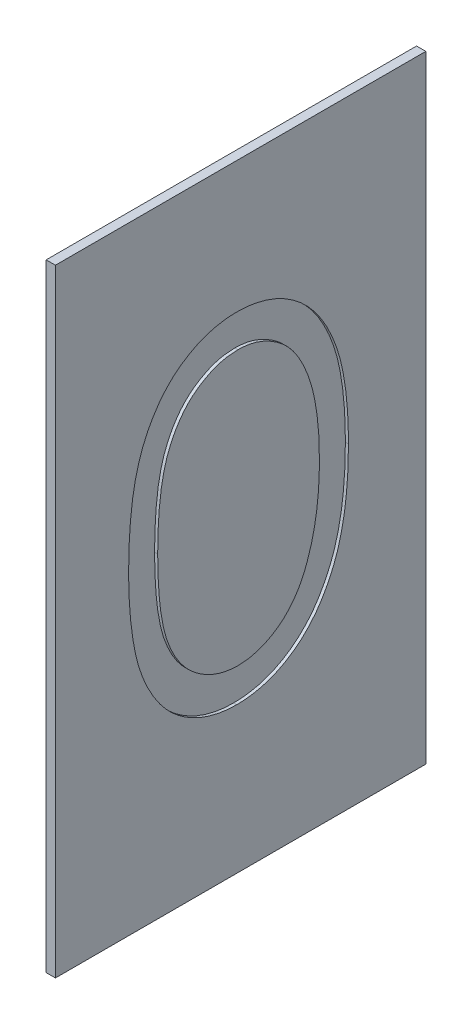
from build123d import *

# Parameters (mm, degrees)
SKETCH1_W           = 60
SKETCH1_H           = 100
BOSS_EXTRUDE1_DEPTH = 1.5
CUT_EXTRUDE1_DEPTH  = 0.5


with BuildPart() as part:
    # Sketch1 → Boss-Extrude1 (new body)
    with BuildSketch(Plane(origin=(0, 0, 0), x_dir=(0, 0, -1), z_dir=(1, 0, 0))):
        with Locations((30, 50)):
            Rectangle(SKETCH1_W, SKETCH1_H)
    extrude(amount=BOSS_EXTRUDE1_DEPTH)

    # Sketch2 → Cut-Extrude1 (cut)
    with BuildSketch(Plane(origin=(1.5, 0, 0), x_dir=(0, 0, -1), z_dir=(1, 0, 0))):
        with BuildLine():
            add(Edge.make_bspline(
                [(11.861572266, 51.178957621), (11.866483157, 52.01881409), (11.876022634, 53.650247385), (11.982146224, 56.027475881), (12.158439592, 58.257620052), (12.400038666, 60.340786644), (12.694046737, 62.277513452), (13.08652929, 64.062624774), (13.532868703, 65.704382682), (14.050167214, 67.208140834), (14.633869024, 68.594158719), (15.269169344, 69.888065036), (15.981280939, 71.087902015), (16.729505327, 72.212819981), (17.544130252, 73.244404803), (18.401973402, 74.197224604), (19.336516322, 75.049258251), (20.315990392, 75.825470017), (21.349263533, 76.505912268), (22.406883193, 77.105258438), (23.496129033, 77.617278353), (24.619974934, 78.019865843), (25.768319661, 78.352393329), (26.945177551, 78.57979315), (28.152491721, 78.722873456), (28.967406541, 78.736552342), (29.380690257, 78.743489583)],
                knots=[0, 0, 0, 0, 1.646270934, 3.197905019, 4.663502075, 6.030701355, 7.308322542, 8.50163776, 9.611534131, 10.641858119, 11.616356847, 12.558055219, 13.465016945, 14.349605745, 15.204443733, 16.039544428, 16.859896111, 17.680448484, 18.487036065, 19.28249412, 20.06191084, 20.843045899, 21.620316918, 22.403196591, 23.190181807, 24, 24, 24, 24], degree=3))
            add(Edge.make_bspline(
                [(29.380690257, 78.743489583), (29.797426358, 78.736186307), (30.626183347, 78.721662388), (31.851448395, 78.582069908), (33.048407114, 78.350445526), (34.211956508, 78.022257832), (35.351654181, 77.61510046), (36.458585764, 77.104768572), (37.539626914, 76.510720351), (38.577598427, 75.812695603), (39.583895365, 75.034448119), (40.53380024, 74.15468866), (41.427399518, 73.182300389), (42.275908223, 72.127687021), (43.055253425, 70.97062105), (43.797437142, 69.731226973), (44.46174867, 68.387830244), (45.101546615, 66.962845324), (45.653796473, 65.416843713), (46.151838759, 63.758540103), (46.554254567, 61.968347042), (46.889453334, 60.055657106), (47.149130721, 58.01344602), (47.338259067, 55.846091507), (47.438164497, 53.552167648), (47.456979074, 51.983795915), (47.466634115, 51.178957621)],
                knots=[0, 0, 0, 0, 0.810914788, 1.612654377, 2.396697861, 3.181598691, 3.963628158, 4.749916497, 5.551656086, 6.361998678, 7.18212741, 8.025565596, 8.878627764, 9.750805457, 10.657531673, 11.591944965, 12.560506719, 13.57287815, 14.630710178, 15.753379473, 16.941251878, 18.199788006, 19.531962791, 20.947069417, 22.433333509, 24, 24, 24, 24], degree=3))
            add(Edge.make_bspline(
                [(47.466634115, 51.178957621), (47.456878981, 50.37762975), (47.437871502, 48.816275072), (47.339379047, 46.532672726), (47.145370188, 44.376820324), (46.902683958, 42.343547476), (46.566561596, 40.441316956), (46.153273591, 38.663546241), (45.694395327, 37.002558092), (45.127955466, 35.471959765), (44.507979129, 34.050399477), (43.833439735, 32.722928074), (43.110772828, 31.477812184), (42.323445656, 30.325018121), (41.484247548, 29.256379647), (40.575217204, 28.290759896), (39.621979364, 27.404892058), (38.612721076, 26.616623447), (37.558561531, 25.926669372), (36.481233359, 25.309640305), (35.361621363, 24.812100312), (34.225098132, 24.38489078), (33.055407059, 24.05850748), (31.854006192, 23.83283075), (30.627006546, 23.674555371), (29.797567518, 23.662481237), (29.380690257, 23.65641276)],
                knots=[0, 0, 0, 0, 1.561518951, 3.042555995, 4.452378317, 5.7783523, 7.031515105, 8.214008947, 9.334062868, 10.386615937, 11.391082383, 12.354592575, 13.286541444, 14.194233754, 15.072674879, 15.931287219, 16.775624067, 17.606195743, 18.42308326, 19.229000347, 20.022332153, 20.807536673, 21.593273796, 22.3848459, 23.188221202, 24, 24, 24, 24], degree=3))
            add(Edge.make_bspline(
                [(29.380690257, 23.65641276), (28.967418006, 23.663394755), (28.152525794, 23.677161885), (26.945046018, 23.819595771), (25.773048192, 24.048590878), (24.630748974, 24.369227439), (23.512287804, 24.761700257), (22.43290541, 25.273028738), (21.380600335, 25.861914845), (20.358180088, 26.532565047), (19.384856977, 27.300922528), (18.455153875, 28.150763438), (17.592426626, 29.103295021), (16.789449091, 30.143476845), (16.026295593, 31.261739303), (15.324295998, 32.473350402), (14.674973564, 33.773505919), (14.081454981, 35.170605749), (13.555230257, 36.685036704), (13.090402579, 38.334124188), (12.723391305, 40.132423503), (12.409247074, 42.06549134), (12.155865354, 44.141634314), (11.98288092, 46.361979541), (11.875965432, 48.725143407), (11.866457538, 50.346093579), (11.861572266, 51.178957621)],
                knots=[0, 0, 0, 0, 0.810891512, 1.598919785, 2.382837074, 3.152667961, 3.926044502, 4.706494248, 5.493654104, 6.291793342, 7.103789334, 7.925228297, 8.761435821, 9.622817696, 10.50288917, 11.416980706, 12.369136599, 13.353924996, 14.394355917, 15.514179734, 16.714354668, 17.994756427, 19.357759367, 20.818452758, 22.365282078, 24, 24, 24, 24], degree=3))
        make_face()
        with BuildLine():
            add(Edge.make_bspline(
                [(16.564127604, 51.199951172), (16.565915894, 50.500057671), (16.569386614, 49.141701818), (16.660056419, 47.167823532), (16.783573948, 45.326785469), (16.942889072, 43.616249997), (17.179481346, 42.042007029), (17.444576761, 40.593229331), (17.767181844, 39.277584005), (18.148877972, 38.086043002), (18.583633926, 36.998384689), (19.058315115, 35.986299812), (19.568251845, 35.037832588), (20.138948921, 34.161502485), (20.760487566, 33.354451704), (21.418828848, 32.602395844), (22.138542767, 31.931722288), (23.134196943, 31.127356015), (24.448633139, 30.296156819), (26.104776297, 29.572348137), (27.80655222, 29.117480208), (28.961614497, 29.05963437), (29.538141886, 29.030761719)],
                knots=[0, 0, 0, 0, 1.459021318, 2.831673884, 4.118529203, 5.306027144, 6.411944654, 7.436330062, 8.375795394, 9.233974572, 10.042671642, 10.816086306, 11.563610507, 12.285937304, 12.993564865, 13.685989202, 14.367179055, 15.041617293, 16.353048772, 17.594441528, 18.799311195, 20, 20, 20, 20], degree=3))
            add(Edge.make_bspline(
                [(29.538141886, 29.030761719), (30.118398518, 29.054682735), (31.277713767, 29.102475381), (32.971485144, 29.563575618), (34.615798123, 30.259289713), (35.904415627, 31.081930832), (36.884781023, 31.865359219), (37.58719408, 32.533302994), (38.23189326, 33.281212299), (38.843356327, 34.088160254), (39.404171158, 34.969563803), (39.91414404, 35.921184585), (40.379505291, 36.945665225), (40.644634513, 37.660845129), (40.780188243, 38.026498159)],
                knots=[0, 0, 0, 0, 1.353760809, 2.704726607, 4.075137775, 5.516104923, 6.260822281, 7.007110065, 7.778089737, 8.566572457, 9.372053459, 10.217411131, 11.088608312, 12, 12, 12, 12], degree=3))
            add(Edge.make_bspline(
                [(40.780188243, 38.026498159), (40.938162986, 38.494051101), (41.258919464, 39.443384088), (41.6723064, 40.916025735), (41.997865484, 42.461115664), (42.290756471, 44.069420128), (42.490670421, 45.752799943), (42.65158024, 47.506046538), (42.746359491, 49.330481818), (42.758108313, 50.570038805), (42.764078776, 51.199951172)],
                knots=[0, 0, 0, 0, 0.884706709, 1.796334032, 2.740027952, 3.714592787, 4.726048262, 5.777819803, 6.87074269, 8, 8, 8, 8], degree=3))
            add(Edge.make_bspline(
                [(42.764078776, 51.199951172), (42.755841673, 51.829761655), (42.739728137, 53.061805598), (42.678135979, 54.866131568), (42.519086189, 56.579874281), (42.342436853, 58.210416604), (42.081976085, 59.748732555), (41.801145443, 61.20770012), (41.423847996, 62.569244583), (41.020821259, 63.854682782), (40.559546483, 65.049410354), (40.051780436, 66.158997545), (39.509489973, 67.188801219), (38.920481528, 68.135995951), (38.29174733, 69.004824402), (37.606692727, 69.777866606), (36.892491448, 70.479081622), (35.892144588, 71.279491165), (34.582531947, 72.095607599), (32.952960149, 72.84665929), (31.25713995, 73.277959781), (30.110728088, 73.338768925), (29.538141886, 73.369140625)],
                knots=[0, 0, 0, 0, 1.31362396, 2.569729283, 3.763502607, 4.902122613, 5.988968491, 7.01645872, 7.998833611, 8.933434873, 9.825090667, 10.667526885, 11.477055099, 12.250526234, 12.991942729, 13.710640831, 14.402115721, 15.076753259, 16.378508321, 17.609869233, 18.806226677, 20, 20, 20, 20], degree=3))
            add(Edge.make_bspline(
                [(29.538141886, 73.369140625), (28.958590102, 73.338727023), (27.798430729, 73.277844414), (26.084984543, 72.848266218), (24.442556739, 72.099502066), (23.13640721, 71.27678808), (22.135362672, 70.493210249), (21.430468804, 69.81371146), (20.769538772, 69.070437494), (20.160686339, 68.25596463), (19.590436419, 67.380656191), (19.066721664, 66.437626156), (18.594863093, 65.422095624), (18.159426849, 64.334925875), (17.776566393, 63.14348767), (17.460760218, 61.8294629), (17.169011738, 60.385293269), (16.96247724, 58.802524157), (16.778871639, 57.091560249), (16.660876821, 55.245926125), (16.569083308, 53.268737372), (16.565812591, 51.903358229), (16.564127604, 51.199951172)],
                knots=[0, 0, 0, 0, 1.207732386, 2.417664972, 3.655092373, 4.956220595, 5.625982001, 6.301752483, 6.994047911, 7.697131622, 8.419323945, 9.170223765, 9.943494443, 10.752040957, 11.610060368, 12.549350801, 13.567764191, 14.679664412, 15.874934091, 17.154273443, 18.533957287, 20, 20, 20, 20], degree=3))
        make_face(mode=Mode.SUBTRACT)
    extrude(amount=-CUT_EXTRUDE1_DEPTH, mode=Mode.SUBTRACT)


solid = part.part
